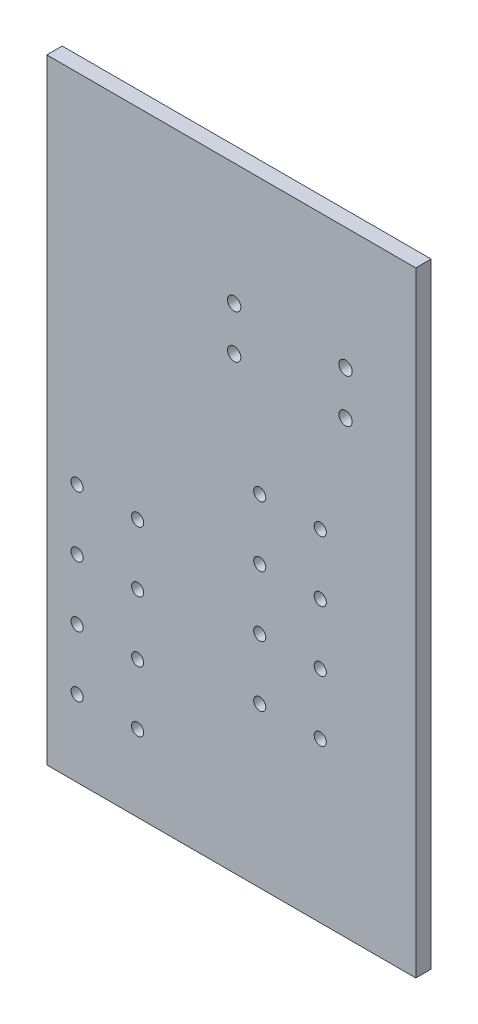
from build123d import *

# Parameters (mm, degrees)
SKETCH1_W           = 152.4
SKETCH1_H           = 254
BOSS_EXTRUDE1_DEPTH = 6.35
CUT_EXTRUDE2_REACH  = 150.242
SKETCH3_R           = 2.5
CUT_EXTRUDE3_REACH  = 150.242
SKETCH4_R           = 2.75


with BuildPart() as part:
    # Sketch1 → Boss-Extrude1 (new body)
    with BuildSketch(Plane.XY):
        Rectangle(SKETCH1_W, SKETCH1_H)
    extrude(amount=BOSS_EXTRUDE1_DEPTH)

    # Sketch3 → Cut-Extrude2 (cut, up to next)
    with BuildSketch(Plane(origin=(0, 0, 0), x_dir=(-1, 0, 0), z_dir=(0, 0, -1)), mode=Mode.PRIVATE) as cut_extrude2_sk1:
        with Locations((63.7, -20.45)):
            Circle(SKETCH3_R)
    cut_extrude2_tool1 = extrude(cut_extrude2_sk1.sketch, amount=-CUT_EXTRUDE2_REACH, mode=Mode.PRIVATE) & part.part
    # Sketch3 → Cut-Extrude2 (cut, up to next)
    with BuildSketch(Plane(origin=(0, 0, 0), x_dir=(-1, 0, 0), z_dir=(0, 0, -1)), mode=Mode.PRIVATE) as cut_extrude2_sk2:
        with Locations((38.7, -20.45)):
            Circle(SKETCH3_R)
    cut_extrude2_tool2 = extrude(cut_extrude2_sk2.sketch, amount=-CUT_EXTRUDE2_REACH, mode=Mode.PRIVATE) & part.part
    # Sketch3 → Cut-Extrude2 (cut, up to next)
    with BuildSketch(Plane(origin=(0, 0, 0), x_dir=(-1, 0, 0), z_dir=(0, 0, -1)), mode=Mode.PRIVATE) as cut_extrude2_sk3:
        with Locations((38.7, -45.45)):
            Circle(SKETCH3_R)
    cut_extrude2_tool3 = extrude(cut_extrude2_sk3.sketch, amount=-CUT_EXTRUDE2_REACH, mode=Mode.PRIVATE) & part.part
    # Sketch3 → Cut-Extrude2 (cut, up to next)
    with BuildSketch(Plane(origin=(0, 0, 0), x_dir=(-1, 0, 0), z_dir=(0, 0, -1)), mode=Mode.PRIVATE) as cut_extrude2_sk4:
        with Locations((63.7, -45.45)):
            Circle(SKETCH3_R)
    cut_extrude2_tool4 = extrude(cut_extrude2_sk4.sketch, amount=-CUT_EXTRUDE2_REACH, mode=Mode.PRIVATE) & part.part
    # Sketch3 → Cut-Extrude2 (cut, up to next)
    with BuildSketch(Plane(origin=(0, 0, 0), x_dir=(-1, 0, 0), z_dir=(0, 0, -1)), mode=Mode.PRIVATE) as cut_extrude2_sk5:
        with Locations((63.7, -70.45)):
            Circle(SKETCH3_R)
    cut_extrude2_tool5 = extrude(cut_extrude2_sk5.sketch, amount=-CUT_EXTRUDE2_REACH, mode=Mode.PRIVATE) & part.part
    # Sketch3 → Cut-Extrude2 (cut, up to next)
    with BuildSketch(Plane(origin=(0, 0, 0), x_dir=(-1, 0, 0), z_dir=(0, 0, -1)), mode=Mode.PRIVATE) as cut_extrude2_sk6:
        with Locations((38.7, -70.45)):
            Circle(SKETCH3_R)
    cut_extrude2_tool6 = extrude(cut_extrude2_sk6.sketch, amount=-CUT_EXTRUDE2_REACH, mode=Mode.PRIVATE) & part.part
    # Sketch3 → Cut-Extrude2 (cut, up to next)
    with BuildSketch(Plane(origin=(0, 0, 0), x_dir=(-1, 0, 0), z_dir=(0, 0, -1)), mode=Mode.PRIVATE) as cut_extrude2_sk7:
        with Locations((38.7, -95.45)):
            Circle(SKETCH3_R)
    cut_extrude2_tool7 = extrude(cut_extrude2_sk7.sketch, amount=-CUT_EXTRUDE2_REACH, mode=Mode.PRIVATE) & part.part
    # Sketch3 → Cut-Extrude2 (cut, up to next)
    with BuildSketch(Plane(origin=(0, 0, 0), x_dir=(-1, 0, 0), z_dir=(0, 0, -1)), mode=Mode.PRIVATE) as cut_extrude2_sk8:
        with Locations((63.7, -95.45)):
            Circle(SKETCH3_R)
    cut_extrude2_tool8 = extrude(cut_extrude2_sk8.sketch, amount=-CUT_EXTRUDE2_REACH, mode=Mode.PRIVATE) & part.part
    # Sketch3 → Cut-Extrude2 (cut, up to next)
    with BuildSketch(Plane(origin=(0, 0, 0), x_dir=(-1, 0, 0), z_dir=(0, 0, -1)), mode=Mode.PRIVATE) as cut_extrude2_sk9:
        with Locations((-11.738, -61.16)):
            Circle(SKETCH3_R)
    cut_extrude2_tool9 = extrude(cut_extrude2_sk9.sketch, amount=-CUT_EXTRUDE2_REACH, mode=Mode.PRIVATE) & part.part
    # Sketch3 → Cut-Extrude2 (cut, up to next)
    with BuildSketch(Plane(origin=(0, 0, 0), x_dir=(-1, 0, 0), z_dir=(0, 0, -1)), mode=Mode.PRIVATE) as cut_extrude2_sk10:
        with Locations((-11.738, -36.16)):
            Circle(SKETCH3_R)
    cut_extrude2_tool10 = extrude(cut_extrude2_sk10.sketch, amount=-CUT_EXTRUDE2_REACH, mode=Mode.PRIVATE) & part.part
    # Sketch3 → Cut-Extrude2 (cut, up to next)
    with BuildSketch(Plane(origin=(0, 0, 0), x_dir=(-1, 0, 0), z_dir=(0, 0, -1)), mode=Mode.PRIVATE) as cut_extrude2_sk11:
        with Locations((-36.738, -61.16)):
            Circle(SKETCH3_R)
    cut_extrude2_tool11 = extrude(cut_extrude2_sk11.sketch, amount=-CUT_EXTRUDE2_REACH, mode=Mode.PRIVATE) & part.part
    # Sketch3 → Cut-Extrude2 (cut, up to next)
    with BuildSketch(Plane(origin=(0, 0, 0), x_dir=(-1, 0, 0), z_dir=(0, 0, -1)), mode=Mode.PRIVATE) as cut_extrude2_sk12:
        with Locations((-36.738, -36.16)):
            Circle(SKETCH3_R)
    cut_extrude2_tool12 = extrude(cut_extrude2_sk12.sketch, amount=-CUT_EXTRUDE2_REACH, mode=Mode.PRIVATE) & part.part
    # Sketch3 → Cut-Extrude2 (cut, up to next)
    with BuildSketch(Plane(origin=(0, 0, 0), x_dir=(-1, 0, 0), z_dir=(0, 0, -1)), mode=Mode.PRIVATE) as cut_extrude2_sk13:
        with Locations((-11.738, -11.16)):
            Circle(SKETCH3_R)
    cut_extrude2_tool13 = extrude(cut_extrude2_sk13.sketch, amount=-CUT_EXTRUDE2_REACH, mode=Mode.PRIVATE) & part.part
    # Sketch3 → Cut-Extrude2 (cut, up to next)
    with BuildSketch(Plane(origin=(0, 0, 0), x_dir=(-1, 0, 0), z_dir=(0, 0, -1)), mode=Mode.PRIVATE) as cut_extrude2_sk14:
        with Locations((-36.738, -11.16)):
            Circle(SKETCH3_R)
    cut_extrude2_tool14 = extrude(cut_extrude2_sk14.sketch, amount=-CUT_EXTRUDE2_REACH, mode=Mode.PRIVATE) & part.part
    # Sketch3 → Cut-Extrude2 (cut, up to next)
    with BuildSketch(Plane(origin=(0, 0, 0), x_dir=(-1, 0, 0), z_dir=(0, 0, -1)), mode=Mode.PRIVATE) as cut_extrude2_sk15:
        with Locations((-36.738, 13.84)):
            Circle(SKETCH3_R)
    cut_extrude2_tool15 = extrude(cut_extrude2_sk15.sketch, amount=-CUT_EXTRUDE2_REACH, mode=Mode.PRIVATE) & part.part
    # Sketch3 → Cut-Extrude2 (cut, up to next)
    with BuildSketch(Plane(origin=(0, 0, 0), x_dir=(-1, 0, 0), z_dir=(0, 0, -1)), mode=Mode.PRIVATE) as cut_extrude2_sk16:
        with Locations((-11.738, 13.84)):
            Circle(SKETCH3_R)
    cut_extrude2_tool16 = extrude(cut_extrude2_sk16.sketch, amount=-CUT_EXTRUDE2_REACH, mode=Mode.PRIVATE) & part.part
    add(cut_extrude2_tool1.solids().sort_by_distance((-63.7, -20.45, 0))[0], mode=Mode.SUBTRACT)
    add(cut_extrude2_tool2.solids().sort_by_distance((-38.7, -20.45, 0))[0], mode=Mode.SUBTRACT)
    add(cut_extrude2_tool3.solids().sort_by_distance((-38.7, -45.45, 0))[0], mode=Mode.SUBTRACT)
    add(cut_extrude2_tool4.solids().sort_by_distance((-63.7, -45.45, 0))[0], mode=Mode.SUBTRACT)
    add(cut_extrude2_tool5.solids().sort_by_distance((-63.7, -70.45, 0))[0], mode=Mode.SUBTRACT)
    add(cut_extrude2_tool6.solids().sort_by_distance((-38.7, -70.45, 0))[0], mode=Mode.SUBTRACT)
    add(cut_extrude2_tool7.solids().sort_by_distance((-38.7, -95.45, 0))[0], mode=Mode.SUBTRACT)
    add(cut_extrude2_tool8.solids().sort_by_distance((-63.7, -95.45, 0))[0], mode=Mode.SUBTRACT)
    add(cut_extrude2_tool9.solids().sort_by_distance((11.738, -61.16, 0))[0], mode=Mode.SUBTRACT)
    add(cut_extrude2_tool10.solids().sort_by_distance((11.738, -36.16, 0))[0], mode=Mode.SUBTRACT)
    add(cut_extrude2_tool11.solids().sort_by_distance((36.738, -61.16, 0))[0], mode=Mode.SUBTRACT)
    add(cut_extrude2_tool12.solids().sort_by_distance((36.738, -36.16, 0))[0], mode=Mode.SUBTRACT)
    add(cut_extrude2_tool13.solids().sort_by_distance((11.738, -11.16, 0))[0], mode=Mode.SUBTRACT)
    add(cut_extrude2_tool14.solids().sort_by_distance((36.738, -11.16, 0))[0], mode=Mode.SUBTRACT)
    add(cut_extrude2_tool15.solids().sort_by_distance((36.738, 13.84, 0))[0], mode=Mode.SUBTRACT)
    add(cut_extrude2_tool16.solids().sort_by_distance((11.738, 13.84, 0))[0], mode=Mode.SUBTRACT)

    # Sketch4 → Cut-Extrude3 (cut, up to next)
    with BuildSketch(Plane(origin=(0, 0, 0), x_dir=(-1, 0, 0), z_dir=(0, 0, -1)), mode=Mode.PRIVATE) as cut_extrude3_sk1:
        with Locations((-47.180499962, 58.762402402)):
            Circle(SKETCH4_R)
    cut_extrude3_tool1 = extrude(cut_extrude3_sk1.sketch, amount=-CUT_EXTRUDE3_REACH, mode=Mode.PRIVATE) & part.part
    # Sketch4 → Cut-Extrude3 (cut, up to next)
    with BuildSketch(Plane(origin=(0, 0, 0), x_dir=(-1, 0, 0), z_dir=(0, 0, -1)), mode=Mode.PRIVATE) as cut_extrude3_sk2:
        with Locations((-1.180499962, 58.762402402)):
            Circle(SKETCH4_R)
    cut_extrude3_tool2 = extrude(cut_extrude3_sk2.sketch, amount=-CUT_EXTRUDE3_REACH, mode=Mode.PRIVATE) & part.part
    # Sketch4 → Cut-Extrude3 (cut, up to next)
    with BuildSketch(Plane(origin=(0, 0, 0), x_dir=(-1, 0, 0), z_dir=(0, 0, -1)), mode=Mode.PRIVATE) as cut_extrude3_sk3:
        with Locations((-47.180499962, 76.762402402)):
            Circle(SKETCH4_R)
    cut_extrude3_tool3 = extrude(cut_extrude3_sk3.sketch, amount=-CUT_EXTRUDE3_REACH, mode=Mode.PRIVATE) & part.part
    # Sketch4 → Cut-Extrude3 (cut, up to next)
    with BuildSketch(Plane(origin=(0, 0, 0), x_dir=(-1, 0, 0), z_dir=(0, 0, -1)), mode=Mode.PRIVATE) as cut_extrude3_sk4:
        with Locations((-1.180499962, 76.762402402)):
            Circle(SKETCH4_R)
    cut_extrude3_tool4 = extrude(cut_extrude3_sk4.sketch, amount=-CUT_EXTRUDE3_REACH, mode=Mode.PRIVATE) & part.part
    add(cut_extrude3_tool1.solids().sort_by_distance((47.1805, 58.762402, 0))[0], mode=Mode.SUBTRACT)
    add(cut_extrude3_tool2.solids().sort_by_distance((1.1805, 58.762402, 0))[0], mode=Mode.SUBTRACT)
    add(cut_extrude3_tool3.solids().sort_by_distance((47.1805, 76.762402, 0))[0], mode=Mode.SUBTRACT)
    add(cut_extrude3_tool4.solids().sort_by_distance((1.1805, 76.762402, 0))[0], mode=Mode.SUBTRACT)


solid = part.part
